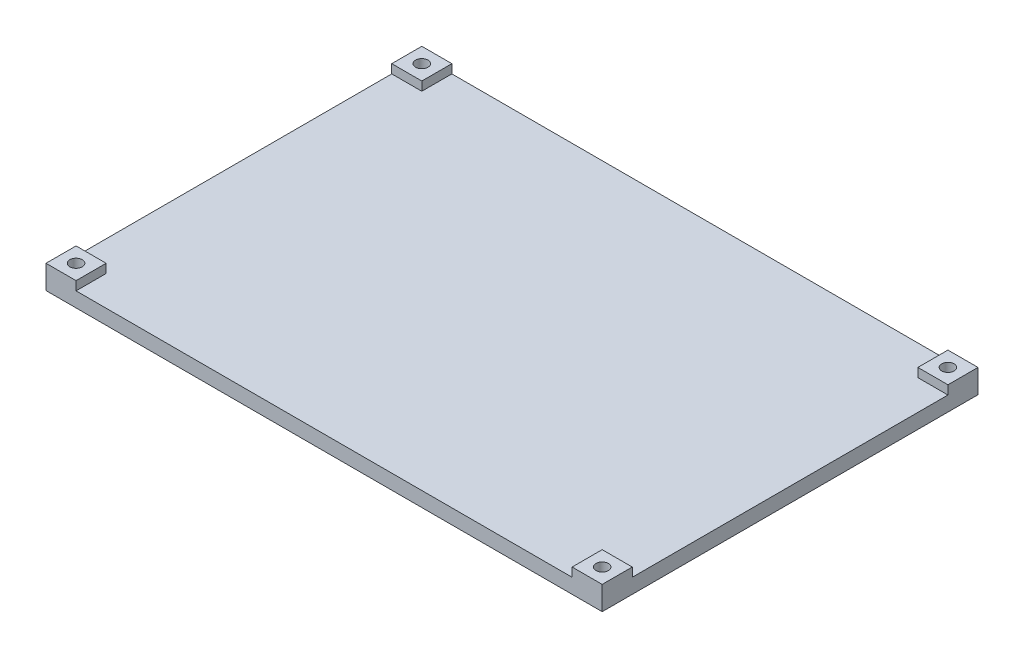
from build123d import *

# Parameters (mm, degrees)
SKETCH_1_W           = 93.98
SKETCH_1_H           = 63.5
SKETCH_1_R           = 1.05
EXTRUDE_1_DEPTH      = 4
SKETCH_2_OUTSIDE_W   = 118.678
SKETCH_2_OUTSIDE_H   = 88.198
SKETCH_2_OUTSIDE_W_2 = 5.08
SKETCH_2_OUTSIDE_H_2 = 5.08
CUT_EXTRUDE_1_DEPTH  = 1.5
SKETCH_3_R           = 2.6
CUT_EXTRUDE_2_DEPTH  = 0.8


with BuildPart() as part:
    # 草图1 → 凸台-拉伸1 (new body)
    with BuildSketch(Plane(origin=(0, 0, 0), x_dir=(1, 0, 0), z_dir=(0, 1, 0))):
        Rectangle(SKETCH_1_W, SKETCH_1_H)
        with Locations(Location((-44.45, 29.21, 0), (0, 0, 270))):
            Circle(SKETCH_1_R, mode=Mode.SUBTRACT)
        with Locations(Location((-44.45, -29.21, 0), (0, 0, 270))):
            Circle(SKETCH_1_R, mode=Mode.SUBTRACT)
        with Locations(Location((44.45, 29.21, 0), (0, 0, 270))):
            Circle(SKETCH_1_R, mode=Mode.SUBTRACT)
        with Locations(Location((44.45, -29.21, 0), (0, 0, 270))):
            Circle(SKETCH_1_R, mode=Mode.SUBTRACT)
    extrude(amount=EXTRUDE_1_DEPTH)

    # 草图2 outside → 切除-拉伸1 (cut)
    with BuildSketch(Plane(origin=(0, 4, 0), x_dir=(1, 0, 0), z_dir=(0, 1, 0))):
        Rectangle(SKETCH_2_OUTSIDE_W, SKETCH_2_OUTSIDE_H)
        with Locations((-44.45, 29.21)):
            Rectangle(SKETCH_2_OUTSIDE_W_2, SKETCH_2_OUTSIDE_H_2, mode=Mode.SUBTRACT)
        with Locations((-44.45, -29.21)):
            Rectangle(SKETCH_2_OUTSIDE_W_2, SKETCH_2_OUTSIDE_H_2, mode=Mode.SUBTRACT)
        with Locations((44.45, -29.21)):
            Rectangle(SKETCH_2_OUTSIDE_W_2, SKETCH_2_OUTSIDE_H_2, mode=Mode.SUBTRACT)
        with Locations((44.45, 29.21)):
            Rectangle(SKETCH_2_OUTSIDE_W_2, SKETCH_2_OUTSIDE_H_2, mode=Mode.SUBTRACT)
    extrude(amount=-CUT_EXTRUDE_1_DEPTH, mode=Mode.SUBTRACT)

    # 草图3 → 切除-拉伸2 (cut)
    with BuildSketch(Plane.XZ):
        with Locations(Location((-36.99, 21.75, 0), (0, 0, 270))):
            Circle(SKETCH_3_R)
        with Locations(Location((-36.99, -21.75, 0), (0, 0, 270))):
            Circle(SKETCH_3_R)
        with Locations(Location((0, 21.75, 0), (0, 0, 270))):
            Circle(SKETCH_3_R)
        with Locations(Location((0, -21.75, 0), (0, 0, 270))):
            Circle(SKETCH_3_R)
        with Locations(Location((36.99, 21.75, 0), (0, 0, 270))):
            Circle(SKETCH_3_R)
        with Locations(Location((36.99, -21.75, 0), (0, 0, 270))):
            Circle(SKETCH_3_R)
    extrude(amount=-CUT_EXTRUDE_2_DEPTH, mode=Mode.SUBTRACT)


solid = part.part
